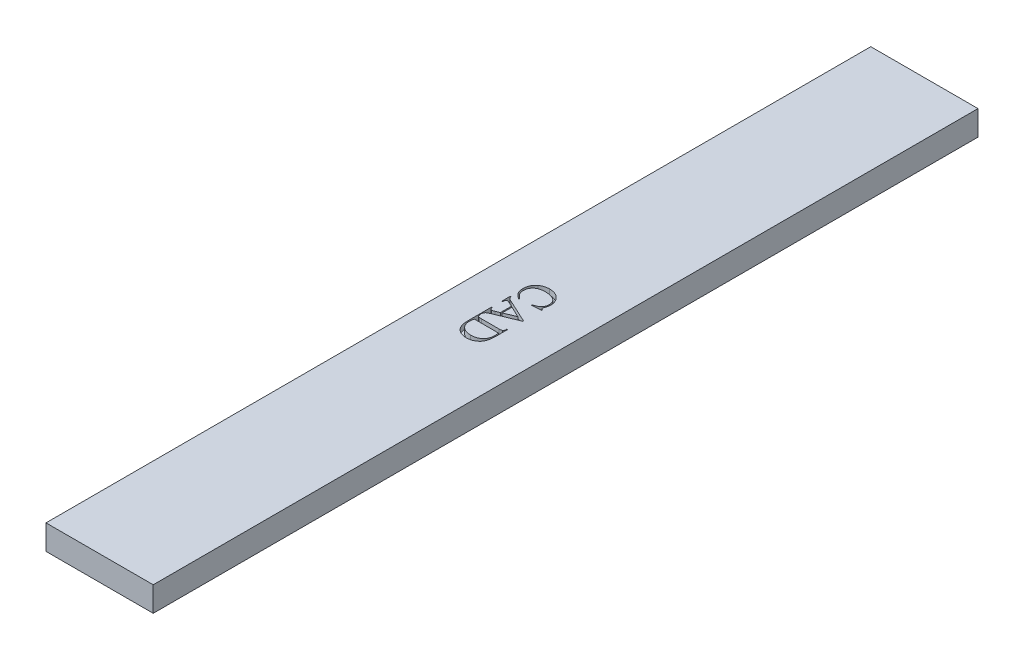
from build123d import *

# Parameters (mm, degrees)
SKETCH1_W           = 19.5
SKETCH1_H           = 4.5
BOSS_EXTRUDE1_DEPTH = 150
CUT_EXTRUDE1_DEPTH  = 1


with BuildPart() as part:
    # Sketch1 → Boss-Extrude1 (new body)
    with BuildSketch(Plane.XY):
        Rectangle(SKETCH1_W, SKETCH1_H)
    extrude(amount=BOSS_EXTRUDE1_DEPTH)

    # Sketch2 → Cut-Extrude1 (cut)
    # profile 1 of 3: a face of its own
    with BuildSketch(Plane(origin=(0, 2.25, 0), x_dir=(1, 0, 0), z_dir=(0, 1, 0))):
        with BuildLine():
            Line((1.852846801, -71.458333333), (0.116735689, -71.597222222))
            Line((0.116735689, -71.597222222), (0.116735689, -71.458333333))
            add(Edge.make_bspline(
                [(0.116735689, -71.458333333), (0.182421545, -71.43987154), (0.309678341, -71.404104501), (0.491595938, -71.340340532), (0.660008517, -71.27310029), (0.813462298, -71.197808434), (0.952891093, -71.117650474), (1.078672884, -71.03201982), (1.189713917, -70.939572346), (1.287139138, -70.841460365), (1.371113501, -70.737363855), (1.444315356, -70.628531878), (1.506073475, -70.514294149), (1.557739695, -70.395482222), (1.597059644, -70.271105973), (1.623187908, -70.141517415), (1.64194085, -70.00741352), (1.643646769, -69.916155607), (1.644513467, -69.869791667)],
                knots=[0, 0, 0, 0, 1.365115603, 2.644713018, 3.855757171, 4.991985138, 6.062154657, 7.072025556, 8.033065275, 8.949227346, 9.834355564, 10.705613414, 11.570382876, 12.429560572, 13.294875113, 14.175017322, 15.072810392, 16, 16, 16, 16], degree=3))
            add(Edge.make_bspline(
                [(1.644513467, -69.869791667), (1.643491798, -69.830712156), (1.641473027, -69.753492907), (1.63108097, -69.639116506), (1.61090375, -69.527951528), (1.58448894, -69.419175076), (1.547585943, -69.313870547), (1.506093451, -69.210208351), (1.454464801, -69.110471054), (1.395855381, -69.013335714), (1.328756652, -68.920124336), (1.252519777, -68.831480065), (1.165878527, -68.749445981), (1.071817364, -68.669992523), (0.965314899, -68.600064917), (0.853023011, -68.530168768), (0.7291814, -68.469217068), (0.597399987, -68.411330462), (0.456217091, -68.360821661), (0.307030367, -68.316117371), (0.149741459, -68.278542364), (-0.015978137, -68.246677635), (-0.190235707, -68.223075581), (-0.373151814, -68.207661763), (-0.563812051, -68.195832085), (-0.693791481, -68.19491274), (-0.760000422, -68.194444444)],
                knots=[0, 0, 0, 0, 0.852513238, 1.684525486, 2.501557535, 3.314657944, 4.122884273, 4.932956222, 5.747891211, 6.569063427, 7.405364907, 8.249848014, 9.114572468, 10.005384121, 10.930865783, 11.890024271, 12.888376645, 13.937630198, 15.028062455, 16.156107303, 17.332750309, 18.553388997, 19.83519646, 21.165691355, 22.556259468, 24, 24, 24, 24], degree=3))
            add(Edge.make_bspline(
                [(-0.760000422, -68.194444444), (-0.814990983, -68.195056792), (-0.923252411, -68.196262336), (-1.082567747, -68.206139702), (-1.236401848, -68.222572403), (-1.384750934, -68.244538568), (-1.527096848, -68.275855217), (-1.664472462, -68.310722007), (-1.795545237, -68.354867296), (-1.921571104, -68.403202575), (-2.04139646, -68.458045062), (-2.152956926, -68.521881818), (-2.259179919, -68.589550603), (-2.356825652, -68.666324214), (-2.448228677, -68.748594947), (-2.532509964, -68.837909997), (-2.607871609, -68.934981472), (-2.677737176, -69.036813173), (-2.739181522, -69.143943574), (-2.79292657, -69.255114126), (-2.837008863, -69.370428821), (-2.874185263, -69.489247217), (-2.903554827, -69.611723217), (-2.924183378, -69.738280119), (-2.936083797, -69.868476559), (-2.93790147, -69.956573358), (-2.938819866, -70.001085069)],
                knots=[0, 0, 0, 0, 1.236790571, 2.434903576, 3.588438759, 4.71597806, 5.805760329, 6.86536762, 7.902118444, 8.914321191, 9.900694802, 10.862335501, 11.803279121, 12.730834146, 13.652376248, 14.567468251, 15.488615281, 16.413741212, 17.343078284, 18.263650361, 19.188239602, 20.117113671, 21.062267979, 22.018525546, 22.998841947, 24, 24, 24, 24], degree=3))
            add(Edge.make_bspline(
                [(-2.938819866, -70.001085069), (-2.936744184, -70.077200882), (-2.932685505, -70.226033735), (-2.89463207, -70.442115844), (-2.834187565, -70.644748022), (-2.762003205, -70.803805634), (-2.687760315, -70.925139357), (-2.621331372, -71.019193465), (-2.541507411, -71.114245271), (-2.450203836, -71.212012911), (-2.346378719, -71.311628871), (-2.231817364, -71.415117917), (-2.103403551, -71.518536631), (-2.013073105, -71.586969678), (-1.966597644, -71.622178819)],
                knots=[0, 0, 0, 0, 1.384369864, 2.706923932, 3.979392615, 5.225429667, 5.872362172, 6.566477539, 7.319183729, 8.12964106, 9.000244434, 9.937306366, 10.938733914, 12, 12, 12, 12], degree=3))
            Line((-1.966597644, -71.622178819), (-2.036042088, -71.736111111))
            add(Edge.make_bspline(
                [(-2.036042088, -71.736111111), (-2.088451958, -71.705537558), (-2.191560543, -71.645388661), (-2.337529926, -71.547910923), (-2.472617153, -71.446800944), (-2.596912804, -71.342155053), (-2.711317955, -71.234331082), (-2.813127149, -71.120531567), (-2.906008857, -71.005055243), (-2.986922386, -70.884333677), (-3.057771278, -70.759239706), (-3.118696006, -70.628115453), (-3.170610498, -70.491799932), (-3.213397354, -70.349723949), (-3.245515697, -70.201603114), (-3.269368362, -70.048010531), (-3.283905009, -69.888519638), (-3.285321075, -69.780485058), (-3.286042088, -69.725477431)],
                knots=[0, 0, 0, 0, 1.164208467, 2.290406175, 3.366281995, 4.400767194, 5.407231672, 6.380278692, 7.328804444, 8.249021907, 9.16593498, 10.085104718, 11.021000282, 11.96307869, 12.929767156, 13.927167342, 14.944582323, 16, 16, 16, 16], degree=3))
            add(Edge.make_bspline(
                [(-3.286042088, -69.725477431), (-3.285537115, -69.675903273), (-3.284540647, -69.578078101), (-3.27303097, -69.43361905), (-3.255998211, -69.293036169), (-3.231510419, -69.156653142), (-3.197776219, -69.024937255), (-3.161349397, -68.896558605), (-3.113337428, -68.773670144), (-3.060919187, -68.65448328), (-3.000567101, -68.539678186), (-2.933504531, -68.428911549), (-2.858353138, -68.32269101), (-2.776823142, -68.220542503), (-2.688791316, -68.1223219), (-2.592574085, -68.02907293), (-2.490328072, -67.938792719), (-2.41692306, -67.883638677), (-2.380009102, -67.855902778)],
                knots=[0, 0, 0, 0, 1.099867591, 2.170379506, 3.21370673, 4.241732154, 5.242319988, 6.230208013, 7.200627964, 8.167156574, 9.118536317, 10.076596279, 11.038581839, 12.003776478, 12.975622664, 13.963217193, 14.975741399, 16, 16, 16, 16], degree=3))
            add(Edge.make_bspline(
                [(-2.380009102, -67.855902778), (-2.323106203, -67.816268008), (-2.209967381, -67.73746304), (-2.029721424, -67.636004863), (-1.841598862, -67.551783936), (-1.646189569, -67.481592144), (-1.44318531, -67.427789745), (-1.232904354, -67.388401706), (-1.015146947, -67.365398189), (-0.867476414, -67.362554115), (-0.792552505, -67.361111111)],
                knots=[0, 0, 0, 0, 0.983430026, 1.955332979, 2.929117015, 3.904576077, 4.897850039, 5.905285016, 6.937200057, 8, 8, 8, 8], degree=3))
            add(Edge.make_bspline(
                [(-0.792552505, -67.361111111), (-0.731771999, -67.362366776), (-0.611498368, -67.364851509), (-0.432649936, -67.378224192), (-0.258320995, -67.405365246), (-0.08694361, -67.439157476), (0.079963712, -67.485855128), (0.244607359, -67.538838598), (0.403636614, -67.60615115), (0.558925191, -67.680590868), (0.707983701, -67.763731974), (0.849829692, -67.854782459), (0.981839129, -67.955021427), (1.106283384, -68.061396299), (1.221546725, -68.175681331), (1.328179486, -68.297493426), (1.426026685, -68.426979926), (1.514837595, -68.563337027), (1.593274222, -68.705188728), (1.663762694, -68.849940104), (1.722135057, -68.998791418), (1.770060559, -69.151046567), (1.806993049, -69.306270144), (1.832764126, -69.46475866), (1.849847156, -69.626362873), (1.851841789, -69.73556115), (1.852846801, -69.790581597)],
                knots=[0, 0, 0, 0, 1.092255407, 2.161375962, 3.219218475, 4.260482765, 5.297825753, 6.331518591, 7.365803668, 8.397635892, 9.42460652, 10.430448635, 11.423444652, 12.400404878, 13.370010219, 14.3371515, 15.30675684, 16.283717067, 17.258296836, 18.217479776, 19.174458709, 20.128144221, 21.083356286, 22.038479922, 23.011672017, 24, 24, 24, 24], degree=3))
            add(Edge.make_bspline(
                [(1.852846801, -69.790581597), (1.850471522, -69.876835583), (1.845715178, -70.049553662), (1.802874831, -70.307031034), (1.738307345, -70.563608892), (1.67313125, -70.729054801), (1.640173189, -70.812717014)],
                knots=[0, 0, 0, 0, 0.984376883, 1.971151638, 2.974057776, 4, 4, 4, 4], degree=3))
            add(Edge.make_bspline(
                [(1.640173189, -70.812717014), (1.630577239, -70.835428343), (1.613053999, -70.876901682), (1.591765937, -70.934514062), (1.578877404, -70.982171694), (1.576214466, -71.010874276), (1.575069023, -71.023220486)],
                knots=[0, 0, 0, 0, 1.336058692, 2.439787325, 3.328885714, 4, 4, 4, 4], degree=3))
            add(Edge.make_bspline(
                [(1.575069023, -71.023220486), (1.577302157, -71.05372404), (1.581714148, -71.113989752), (1.61503645, -71.164360547), (1.631492634, -71.189236111)],
                knots=[0, 0, 0, 0, 1.012302122, 2, 2, 2, 2], degree=3))
            add(Edge.make_bspline(
                [(1.631492634, -71.189236111), (1.645467651, -71.20391598), (1.674013937, -71.233902042), (1.727090771, -71.268766857), (1.786523766, -71.299233408), (1.830151328, -71.31252831), (1.852846801, -71.319444444)],
                knots=[0, 0, 0, 0, 0.931295945, 1.90232619, 2.908770141, 4, 4, 4, 4], degree=3))
            Line((1.852846801, -71.319444444), (1.852846801, -71.458333333))
        make_face()
    # profile 2 of 3: a face of its own
    with BuildSketch(Plane(origin=(0, 2.25, 0), x_dir=(1, 0, 0), z_dir=(0, 1, 0))):
        with BuildLine():
            Line((-1.549930977, -75.553385417), (-1.549930977, -73.560112847))
            Line((-1.549930977, -73.560112847), (-2.337691394, -73.194444444))
            add(Edge.make_bspline(
                [(-2.337691394, -73.194444444), (-2.382327318, -73.175769131), (-2.464652646, -73.141324871), (-2.581240981, -73.102122149), (-2.679745764, -73.075344533), (-2.740493721, -73.071404982), (-2.767378894, -73.069661458)],
                knots=[0, 0, 0, 0, 1.290094603, 2.37941668, 3.282779777, 4, 4, 4, 4], degree=3))
            add(Edge.make_bspline(
                [(-2.767378894, -73.069661458), (-2.78605863, -73.070745338), (-2.823179272, -73.072899238), (-2.875928754, -73.095966616), (-2.925644083, -73.129843867), (-2.962017907, -73.170021907), (-2.989812456, -73.209790723), (-3.007494776, -73.249324654), (-3.023758342, -73.296161256), (-3.037390505, -73.350772131), (-3.050371713, -73.413023177), (-3.062669599, -73.483114494), (-3.070538458, -73.5614909), (-3.07524763, -73.616171094), (-3.077708755, -73.644748264)],
                knots=[0, 0, 0, 0, 0.928585293, 1.845298099, 2.833422532, 3.920951893, 4.532836432, 5.252751675, 6.076265914, 7.010468409, 8.063784373, 9.255881379, 10.565858316, 12, 12, 12, 12], degree=3))
            Line((-3.077708755, -73.644748264), (-3.216597644, -73.644748264))
            Line((-3.216597644, -73.644748264), (-3.216597644, -72.074652778))
            Line((-3.216597644, -72.074652778), (-3.077708755, -72.074652778))
            add(Edge.make_bspline(
                [(-3.077708755, -72.074652778), (-3.067956006, -72.12222826), (-3.050224374, -72.208726027), (-3.016146518, -72.323857244), (-2.978341744, -72.41331659), (-2.943251812, -72.457827711), (-2.927969172, -72.477213542)],
                knots=[0, 0, 0, 0, 1.341417684, 2.438853554, 3.320077337, 4, 4, 4, 4], degree=3))
            add(Edge.make_bspline(
                [(-2.927969172, -72.477213542), (-2.91086354, -72.49341998), (-2.874473324, -72.527897267), (-2.810513012, -72.576858156), (-2.734393957, -72.626300172), (-2.646513312, -72.676921244), (-2.546888551, -72.729209103), (-2.435980941, -72.783182798), (-2.312265823, -72.837463002), (-2.225643772, -72.873085852), (-2.180356324, -72.891710069)],
                knots=[0, 0, 0, 0, 0.657509844, 1.398774721, 2.244567789, 3.190193186, 4.229071695, 5.385194885, 6.63293641, 8, 8, 8, 8], degree=3))
            Line((-2.180356324, -72.891710069), (1.852846801, -74.766710069))
            Line((1.852846801, -74.766710069), (1.852846801, -74.903428819))
            Line((1.852846801, -74.903428819), (-2.268246949, -76.597222222))
            add(Edge.make_bspline(
                [(-2.268246949, -76.597222222), (-2.30783442, -76.613860368), (-2.383970744, -76.645859565), (-2.49105489, -76.697738836), (-2.588760639, -76.745503316), (-2.674823067, -76.793519951), (-2.749982783, -76.839955181), (-2.814299636, -76.885412105), (-2.868030962, -76.929683964), (-2.925052558, -76.988010143), (-2.982742323, -77.069103635), (-3.030600579, -77.182244256), (-3.065007019, -77.310467224), (-3.073344325, -77.402112277), (-3.077708755, -77.450086806)],
                knots=[0, 0, 0, 0, 1.223989839, 2.354029848, 3.391605643, 4.324042249, 5.162387765, 5.909171864, 6.567979791, 7.144041755, 8.231258465, 9.380841669, 10.628917946, 12, 12, 12, 12], degree=3))
            Line((-3.077708755, -77.450086806), (-3.216597644, -77.450086806))
            Line((-3.216597644, -77.450086806), (-3.216597644, -75.476345486))
            Line((-3.216597644, -75.476345486), (-3.077708755, -75.476345486))
            add(Edge.make_bspline(
                [(-3.077708755, -75.476345486), (-3.074828481, -75.522063008), (-3.06955881, -75.605706557), (-3.047179114, -75.718561567), (-3.020707364, -75.809507595), (-2.980123062, -75.876850376), (-2.932549157, -75.924320892), (-2.880733374, -75.957621329), (-2.823864856, -75.978422182), (-2.78418767, -75.980790324), (-2.764123686, -75.981987847)],
                knots=[0, 0, 0, 0, 1.654906515, 3.02777245, 4.157359627, 5.061699779, 5.83887417, 6.568440116, 7.276087863, 8, 8, 8, 8], degree=3))
            add(Edge.make_bspline(
                [(-2.764123686, -75.981987847), (-2.732151387, -75.980038239), (-2.659281152, -75.975594755), (-2.539732596, -75.943177106), (-2.395590341, -75.898558521), (-2.293290229, -75.857661232), (-2.237865005, -75.835503472)],
                knots=[0, 0, 0, 0, 0.698820548, 1.592729354, 2.695763756, 4, 4, 4, 4], degree=3))
            Line((-2.237865005, -75.835503472), (-1.549930977, -75.553385417))
        make_face()
        Polygon((-1.341597644, -75.467664931), (0.665780828, -74.618055556), (-1.341597644, -73.656684028), align=None, mode=Mode.SUBTRACT)
    # profile 3 of 3: a face of its own
    with BuildSketch(Plane(origin=(0, 2.25, 0), x_dir=(1, 0, 0), z_dir=(0, 1, 0))):
        with BuildLine():
            Line((-3.216597644, -77.569444444), (-3.077708755, -77.569444444))
            Line((-3.077708755, -77.569444444), (-3.077708755, -77.750651042))
            add(Edge.make_bspline(
                [(-3.077708755, -77.750651042), (-3.077127508, -77.775279414), (-3.076002814, -77.822934507), (-3.066133342, -77.891719334), (-3.049930618, -77.955082596), (-3.027558928, -78.013066457), (-2.997175962, -78.064518238), (-2.963027435, -78.112167037), (-2.919827607, -78.152665345), (-2.887062422, -78.174633003), (-2.870460491, -78.185763889)],
                knots=[0, 0, 0, 0, 1.170016541, 2.263943595, 3.293731011, 4.273677885, 5.205400736, 6.126759273, 7.050839703, 8, 8, 8, 8], degree=3))
            add(Edge.make_bspline(
                [(-2.870460491, -78.185763889), (-2.858707342, -78.192335985), (-2.83293711, -78.206746118), (-2.786166344, -78.220419621), (-2.731442951, -78.235126368), (-2.666309836, -78.245231439), (-2.592159905, -78.254168472), (-2.507709045, -78.258624688), (-2.414067506, -78.263769489), (-2.348190021, -78.263847952), (-2.313819866, -78.263888889)],
                knots=[0, 0, 0, 0, 0.568271533, 1.246005618, 2.051701561, 2.967781669, 4.031140767, 5.212374137, 6.545616439, 8, 8, 8, 8], degree=3))
            Line((-2.313819866, -78.263888889), (0.880624578, -78.263888889))
            add(Edge.make_bspline(
                [(0.880624578, -78.263888889), (0.91861393, -78.263939844), (0.99065933, -78.264036478), (1.093377012, -78.257815317), (1.18504813, -78.251005434), (1.265504755, -78.240368143), (1.334906103, -78.226502492), (1.392815351, -78.209226597), (1.441523777, -78.190986458), (1.466853734, -78.172541565), (1.478497842, -78.1640625)],
                knots=[0, 0, 0, 0, 1.484107705, 2.814555366, 4.019988359, 5.075390106, 5.984573864, 6.780592097, 7.4394417, 8, 8, 8, 8], degree=3))
            add(Edge.make_bspline(
                [(1.478497842, -78.1640625), (1.504171457, -78.139179083), (1.555782743, -78.08915632), (1.608366314, -77.99050509), (1.63868694, -77.875796819), (1.642500021, -77.793897101), (1.644513467, -77.750651042)],
                knots=[0, 0, 0, 0, 0.928124107, 1.865794122, 2.873060895, 4, 4, 4, 4], degree=3))
            Line((1.644513467, -77.750651042), (1.644513467, -77.569444444))
            Line((1.644513467, -77.569444444), (1.783402356, -77.569444444))
            Line((1.783402356, -77.569444444), (1.783402356, -79.618055556))
            add(Edge.make_bspline(
                [(1.783402356, -79.618055556), (1.782547927, -79.709216135), (1.780889162, -79.886192553), (1.768746316, -80.143127701), (1.750024929, -80.383211805), (1.721697759, -80.606197287), (1.686166615, -80.812642548), (1.643567933, -81.002802386), (1.591626508, -81.175758458), (1.531313414, -81.333132041), (1.462204626, -81.47895054), (1.381613334, -81.615342418), (1.291356884, -81.744883453), (1.190913527, -81.867563929), (1.07898516, -81.982057746), (0.957082749, -82.090191564), (0.823820343, -82.189962063), (0.681628183, -82.282838897), (0.530851147, -82.366438944), (0.373306747, -82.438900605), (0.210397418, -82.501359013), (0.041023863, -82.550585519), (-0.133272431, -82.591884532), (-0.314196854, -82.617477692), (-0.500271713, -82.636332612), (-0.62648579, -82.638028171), (-0.690555977, -82.638888889)],
                knots=[0, 0, 0, 0, 1.467424404, 2.848813797, 4.139820552, 5.342969832, 6.465783635, 7.51097775, 8.478001157, 9.37006111, 10.221662454, 11.072447353, 11.917194129, 12.761097744, 13.621648552, 14.491992016, 15.381654618, 16.298933471, 17.224124012, 18.154138616, 19.088426413, 20.029799095, 20.991637824, 21.969052133, 22.969027765, 24, 24, 24, 24], degree=3))
            add(Edge.make_bspline(
                [(-0.690555977, -82.638888889), (-0.776013976, -82.637206894), (-0.943515576, -82.633910105), (-1.189240084, -82.602258339), (-1.4242372, -82.552818592), (-1.649041984, -82.483441138), (-1.86264138, -82.392924594), (-2.065302691, -82.282238983), (-2.259102902, -82.154063172), (-2.376363822, -82.05213786), (-2.435347644, -82.000868056)],
                knots=[0, 0, 0, 0, 1.077719575, 2.112379846, 3.120154608, 4.104514829, 5.075810074, 6.041644454, 7.014920789, 8, 8, 8, 8], degree=3))
            add(Edge.make_bspline(
                [(-2.435347644, -82.000868056), (-2.467234294, -81.970538358), (-2.531234181, -81.909663439), (-2.619718295, -81.810744866), (-2.702460869, -81.706475699), (-2.778709392, -81.596150824), (-2.849105059, -81.480273609), (-2.913558351, -81.358293029), (-2.970508535, -81.229963595), (-3.02299807, -81.096591667), (-3.068337686, -80.956931753), (-3.108565755, -80.811844638), (-3.14230945, -80.660470902), (-3.168873636, -80.503191717), (-3.190901844, -80.340393619), (-3.205942539, -80.171679171), (-3.214496468, -79.997196497), (-3.215890396, -79.878843233), (-3.216597644, -79.818793403)],
                knots=[0, 0, 0, 0, 0.884547214, 1.775380039, 2.665826882, 3.559504879, 4.469980105, 5.390593375, 6.331323642, 7.291529335, 8.271228182, 9.282197471, 10.317896576, 11.387954191, 12.488469157, 13.620281033, 14.792583212, 16, 16, 16, 16], degree=3))
            Line((-3.216597644, -79.818793403), (-3.216597644, -77.569444444))
        make_face()
        with BuildLine():
            add(Edge.make_bspline(
                [(-2.901927505, -78.958333333), (-2.918323842, -79.035221917), (-2.949607184, -79.181921261), (-2.981153227, -79.393972778), (-3.004233559, -79.586085249), (-3.006971908, -79.708058188), (-3.008264311, -79.765625)],
                knots=[0, 0, 0, 0, 1.156263879, 2.206090244, 3.153339526, 4, 4, 4, 4], degree=3))
            add(Edge.make_bspline(
                [(-3.008264311, -79.765625), (-3.006475819, -79.837347443), (-3.002955646, -79.978514194), (-2.972569541, -80.185233192), (-2.925225827, -80.383181103), (-2.857718801, -80.571728673), (-2.770447229, -80.750787292), (-2.663096471, -80.920084231), (-2.536570945, -81.079707515), (-2.392753014, -81.229663853), (-2.231249049, -81.36443628), (-2.05611669, -81.484121787), (-1.865681441, -81.582477637), (-1.662644667, -81.66432387), (-1.445774403, -81.728460393), (-1.214730168, -81.773478375), (-0.970094041, -81.801103643), (-0.802392934, -81.804048816), (-0.716597644, -81.805555556)],
                knots=[0, 0, 0, 0, 0.997895983, 1.964095595, 2.901912071, 3.827157005, 4.745844758, 5.669115072, 6.611891721, 7.576831244, 8.556021548, 9.534901163, 10.52350778, 11.533221663, 12.578230165, 13.66632696, 14.806101182, 16, 16, 16, 16], degree=3))
            add(Edge.make_bspline(
                [(-0.716597644, -81.805555556), (-0.630080251, -81.804052303), (-0.461298478, -81.801119694), (-0.215553873, -81.773601814), (0.016153425, -81.728302949), (0.233763766, -81.664313119), (0.437629033, -81.582690098), (0.628164317, -81.484383363), (0.802417552, -81.364401902), (0.963195345, -81.229272207), (1.106633873, -81.07888041), (1.232496287, -80.917701882), (1.338336119, -80.74580296), (1.426308012, -80.56406535), (1.491411597, -80.370422184), (1.541264604, -80.168126625), (1.569358419, -79.954853398), (1.573138926, -79.809467985), (1.575069023, -79.735243056)],
                knots=[0, 0, 0, 0, 1.193301075, 2.327941992, 3.40640339, 4.446943273, 5.452345616, 6.432197849, 7.398281103, 8.364982765, 9.32497675, 10.260257213, 11.181170077, 12.105200732, 13.039428948, 13.994364515, 14.976044785, 16, 16, 16, 16], degree=3))
            add(Edge.make_bspline(
                [(1.575069023, -79.735243056), (1.573811995, -79.676231168), (1.571213706, -79.554253075), (1.548947193, -79.365476164), (1.514477191, -79.1651707), (1.482148309, -79.028705476), (1.465477009, -78.958333333)],
                knots=[0, 0, 0, 0, 0.900167399, 1.860653943, 2.896785853, 4, 4, 4, 4], degree=3))
            Line((1.465477009, -78.958333333), (-2.901927505, -78.958333333))
        make_face(mode=Mode.SUBTRACT)
    extrude(amount=-CUT_EXTRUDE1_DEPTH, mode=Mode.SUBTRACT)


solid = part.part
